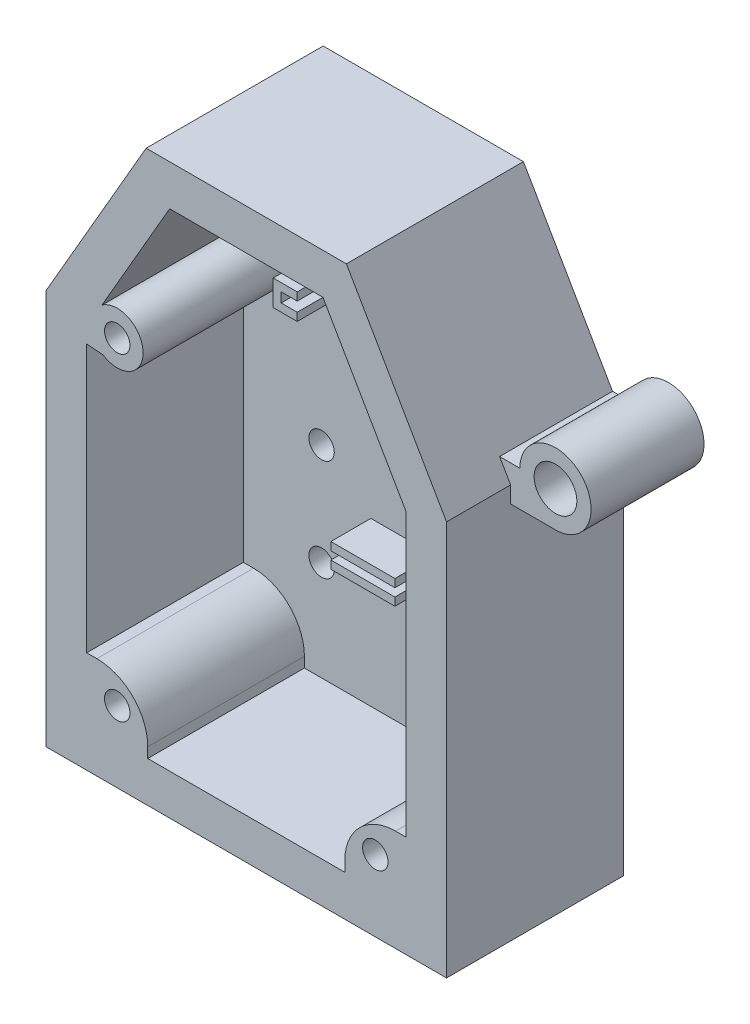
from build123d import *

# Parameters (mm, degrees)
BOSS_EXTRUDE1_DEPTH = 22.098
SKETCH3_R           = 2.667
BOSS_EXTRUDE2_DEPTH = 14.098
SKETCH11_R          = 1.5875
CUT_EXTRUDE7_DEPTH  = 33.02
BOSS_EXTRUDE4_DEPTH = 2.54
SKETCH16_R          = 1.5875
CUT_EXTRUDE11_DEPTH = 2.54
BOSS_EXTRUDE5_DEPTH = 7
CUT_EXTRUDE14_DEPTH = 7
SKETCH22_W          = 8
SKETCH22_H          = 1
BOSS_EXTRUDE6_DEPTH = 5


with BuildPart() as part:
    # Sketch1 → Boss-Extrude1 (new body)
    with BuildSketch(Plane.XY):
        Polygon((-25, 25.4), (-25, -23.909999932), (25, -23.909999932), (25, 25.4), (12.5, 47.050635095), (-12.5, 47.050635095), align=None)
    extrude(amount=BOSS_EXTRUDE1_DEPTH)

    # Sketch3 → Boss-Extrude2 (add)
    with BuildSketch(Plane(origin=(0, 0, 0), x_dir=(-1, 0, 0), z_dir=(0, 0, -1))):
        with BuildLine():
            ThreePointArc((-26.155685571, 27.78125), (-33.743775214, 30.924339642), (-30.600685571, 23.33625))
            Line((-30.600685571, 23.33625), (-25, 23.33625))
            Line((-25, 23.33625), (-25, 25.4))
            Line((-25, 25.4), (-23.625184671, 27.78125))
            Line((-23.625184671, 27.78125), (-26.155685571, 27.78125))
        make_face()
        with Locations((-30.600685571, 27.78125)):
            Circle(SKETCH3_R, mode=Mode.SUBTRACT)
    extrude(amount=-BOSS_EXTRUDE2_DEPTH)

    # Sketch11 → Cut-Extrude7 (cut)
    with BuildSketch(Plane.XY.offset(22.098)):
        with BuildLine():
            Line((-17.892329478, 22.025071278), (-19.92, 22.179409051))
            Line((-19.92, 22.179409051), (-19.92, -11.209999932))
            Line((-19.92, -11.209999932), (-18.65, -11.209999932))
            ThreePointArc((-18.65, -11.209999932), (-14.159871939, -13.069871871), (-12.3, -17.559999932))
            Line((-12.3, -17.559999932), (-12.3, -18.829999932))
            Line((-12.3, -18.829999932), (12.3, -18.829999932))
            Line((12.3, -18.829999932), (12.3, -17.559999932))
            ThreePointArc((12.3, -17.559999932), (14.159871939, -13.069871871), (18.65, -11.209999932))
            Line((18.65, -11.209999932), (19.92, -11.209999932))
            Line((19.92, -11.209999932), (19.92, 24.038818102))
            Line((19.92, 24.038818102), (18.060590949, 27.259409051))
            Line((18.060590949, 27.259409051), (9.567060633, 41.970635095))
            Line((9.567060633, 41.970635095), (-9.567060633, 41.970635095))
            Line((-9.567060633, 41.970635095), (-18.024928281, 27.321178603))
            ThreePointArc((-18.024928281, 27.321178603), (-12.880508254, 24.800266004), (-17.892329478, 22.025071278))
        make_face()
        with Locations((-16.11, 24.719409119)):
            Circle(SKETCH11_R)
        with Locations((16.11, -15.02)):
            Circle(SKETCH11_R)
        with Locations((-16.11, -15.019999932)):
            Circle(SKETCH11_R)
    extrude(amount=-CUT_EXTRUDE7_DEPTH, mode=Mode.SUBTRACT)

    # Sketch12 → Boss-Extrude4 (add)
    with BuildSketch(Plane(origin=(0, 0, 0), x_dir=(-1, 0, 0), z_dir=(0, 0, -1))):
        Polygon((-25, -23.909999932), (25, -23.909999932), (25, 25.4), (12.5, 47.050635095), (-12.5, 47.050635095), (-25, 25.4), align=None)
    extrude(amount=-BOSS_EXTRUDE4_DEPTH)

    # Sketch16 → Cut-Extrude11 (cut)
    with BuildSketch(Plane.XY.offset(2.54)):
        with Locations((-10.16, 6.35)):
            Circle(SKETCH16_R)
        with Locations((-10.16, -6.35)):
            Circle(SKETCH16_R)
        with Locations((10.16, 6.35)):
            Circle(SKETCH16_R)
        with Locations((10.16, -6.35)):
            Circle(SKETCH16_R)
    extrude(amount=-CUT_EXTRUDE11_DEPTH, mode=Mode.SUBTRACT)

    # Sketch20 → Boss-Extrude5 (add)
    with BuildSketch(Plane.XY.offset(2.54)):
        Polygon((-9.198279291, 25.191225954), (-6.198279291, 25.191225954), (-6.198279291, 26.191225954), (-8.198279291, 26.191225954), (-8.198279291, 27.391225954), (-6.198279291, 27.391225954), (-6.198279291, 28.391225954), (-9.198279291, 28.391225954), align=None)
        Polygon((8.198279291, 26.191225954), (8.198279291, 27.391225954), (6.198279291, 27.391225954), (6.198279291, 28.391225954), (9.198279291, 28.391225954), (9.198279291, 25.191225954), (6.198279291, 25.191225954), (6.198279291, 26.191225954), align=None)
    extrude(amount=BOSS_EXTRUDE5_DEPTH)

    # Sketch21 → Cut-Extrude14 (cut)
    with BuildSketch(Plane.XY.offset(2.54)):
        with BuildLine():
            ThreePointArc((0.698279291, 27.391225954), (2.819599635, 28.269905611), (3.698279291, 30.391225954))
            ThreePointArc((3.698279291, 30.391225954), (-1.423041052, 32.512546298), (0.698279291, 27.391225954))
        make_face()
    extrude(amount=-CUT_EXTRUDE14_DEPTH, mode=Mode.SUBTRACT)

    # Sketch22 → Boss-Extrude6 (add)
    with BuildSketch(Plane.XY.offset(2.54)):
        with Locations((0, 1)):
            Rectangle(SKETCH22_W, SKETCH22_H)
        with Locations((0, -1)):
            Rectangle(SKETCH22_W, SKETCH22_H)
    extrude(amount=BOSS_EXTRUDE6_DEPTH)


solid = part.part
